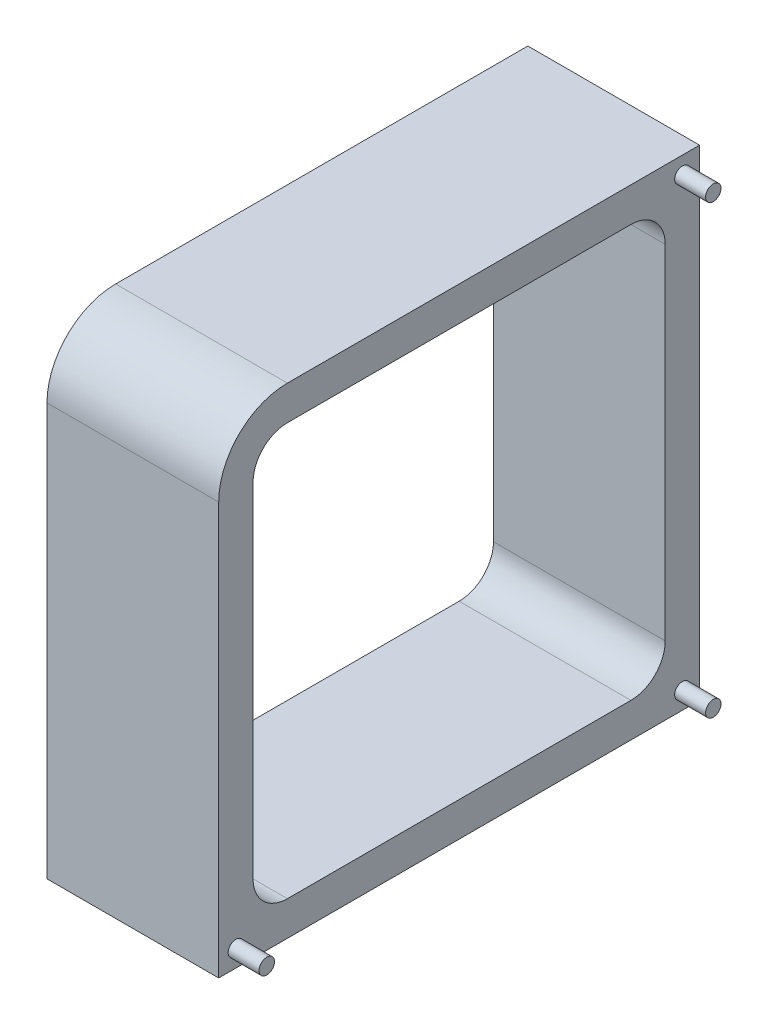
from build123d import *

# Parameters (mm, degrees)
EXTRUDE_1_DEPTH = 50
SKETCH_2_R      = 2.25
EXTRUDE_2_DEPTH = 9


with BuildPart() as part:
    # 草图1 → 凸台-拉伸1 (new body)
    with BuildSketch(Plane(origin=(0, 0, 0), x_dir=(0, 0, -1), z_dir=(1, 0, 0))):
        with BuildLine():
            Line((0, 0), (140, 0))
            Line((140, 0), (140, 140))
            Line((140, 140), (20, 140))
            ThreePointArc((20, 140), (5.857864376, 134.142135624), (0, 120))
            Line((0, 120), (0, 0))
        make_face()
        with BuildLine():
            Line((20, 10), (120, 10))
            ThreePointArc((120, 10), (127.071067812, 12.928932188), (130, 20))
            Line((130, 20), (130, 120))
            ThreePointArc((130, 120), (127.071067812, 127.071067812), (120, 130))
            Line((120, 130), (20, 130))
            ThreePointArc((20, 130), (12.928932188, 127.071067812), (10, 120))
            Line((10, 120), (10, 20))
            ThreePointArc((10, 20), (12.928932188, 12.928932188), (20, 10))
        make_face(mode=Mode.SUBTRACT)
    extrude(amount=EXTRUDE_1_DEPTH)

    # 草图2 → 凸台-拉伸2 (add)
    with BuildSketch(Plane(origin=(50, 0, 0), x_dir=(0, 0, -1), z_dir=(1, 0, 0))):
        with Locations(Location((5, 5, 0), (0, 0, 180))):
            Circle(SKETCH_2_R)
        with Locations(Location((135, 5, 0), (0, 0, 180))):
            Circle(SKETCH_2_R)
        with Locations(Location((135, 135, 0), (0, 0, 180))):
            Circle(SKETCH_2_R)
    extrude(amount=EXTRUDE_2_DEPTH)


solid = part.part
